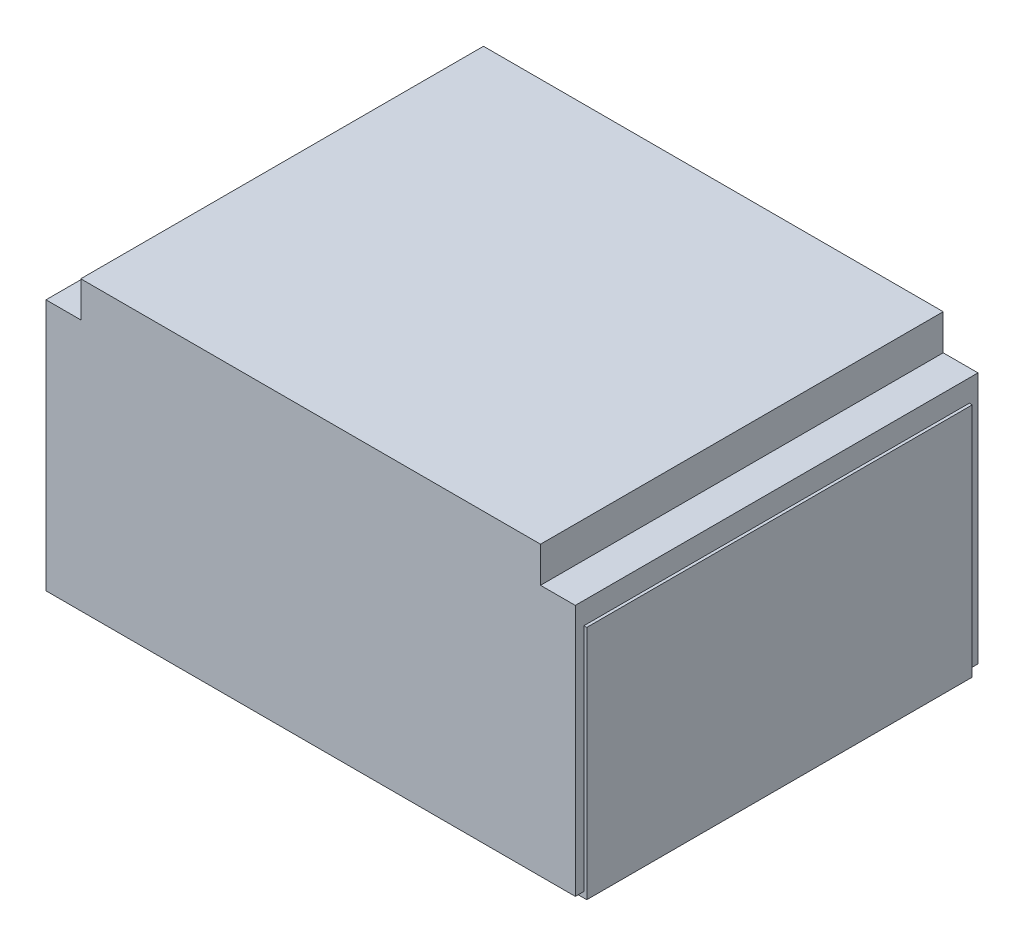
from build123d import *

# Parameters (mm, degrees)
SZKIC1_W                    = 4.6
SZKIC1_H                    = 2.5
DODANIE_WYCI_GNI_CIE1_DEPTH = 3.5
SZKIC2_W                    = 0.302200239
SZKIC2_H                    = 0.309416308
WYTNIJ_WYCI_GNI_CIE1_DEPTH  = 5.370640685
SZKIC3_W                    = 4.65
SZKIC3_H                    = 3.35
DODANIE_WYCI_GNI_CIE2_DEPTH = 0.05
SZKIC4_R                    = 0.162382369
SZKIC4_R_2                  = 1.05
WYTNIJ_WYCI_GNI_CIE2_DEPTH  = 0.05
SZKIC5_R                    = 1
DODANIE_WYCI_GNI_CIE3_DEPTH = 0.4
ZAOKR_GLENIE1_R             = 0.05
SZKIC6_W                    = 0.025
SZKIC6_H                    = 3.35
DODANIE_WYCI_GNI_CIE4_DEPTH = 2


with BuildPart() as part:
    # Szkic1 → Dodanie-wyciągnięcie1 (new body)
    with BuildSketch(Plane.XY):
        Rectangle(SZKIC1_W, SZKIC1_H)
    extrude(amount=DODANIE_WYCI_GNI_CIE1_DEPTH)

    # Szkic2 → Wytnij-wyciągnięcie1 (cut, through all)
    with BuildSketch(Plane.XY.offset(3.5)):
        with Locations((-2.148899881, 1.095291846)):
            Rectangle(SZKIC2_W, SZKIC2_H)
        with Locations((2.148899881, 1.095291846)):
            Rectangle(SZKIC2_W, SZKIC2_H)
    extrude(amount=-WYTNIJ_WYCI_GNI_CIE1_DEPTH, mode=Mode.SUBTRACT)


with BuildPart() as body_2:
    # Szkic3 → Dodanie-wyciągnięcie2 (new body)
    with BuildSketch(Plane.XZ.offset(1.25)):
        with Locations((0, 1.75)):
            Rectangle(SZKIC3_W, SZKIC3_H)
    extrude(amount=DODANIE_WYCI_GNI_CIE2_DEPTH)

    # Szkic4 → Wytnij-wyciągnięcie2 (cut)
    with BuildSketch(Plane.XZ.offset(1.3)):
        with Locations((-1.92312306, 3.089394939)):
            Circle(SZKIC4_R)
        with Locations(Location((1.92312306, 3.089394939, 0), (0, 0, 180))):
            Circle(SZKIC4_R)
        with Locations((0, 1.59590093)):
            Circle(SZKIC4_R_2)
        Polygon((-1.74824974, 0.075), (-1.74824974, 0.441313237), (-1.648322128, 0.441313237), (-1.473448808, 0.191494209), (1.473448808, 0.191494209), (1.648322128, 0.441313237), (1.74824974, 0.441313237), (1.74824974, 0.075), align=None)
    extrude(amount=-WYTNIJ_WYCI_GNI_CIE2_DEPTH, mode=Mode.SUBTRACT)

    # Szkic6 → Dodanie-wyciągnięcie4 (add)
    with BuildSketch(Plane(origin=(0, -1.25, 0), x_dir=(1, 0, 0), z_dir=(0, 1, 0))):
        with Locations((-2.3125, -1.75)):
            Rectangle(SZKIC6_W, SZKIC6_H)
        with Locations((2.3125, -1.75)):
            Rectangle(SZKIC6_W, SZKIC6_H)
    extrude(amount=DODANIE_WYCI_GNI_CIE4_DEPTH)


with BuildPart() as body_3:
    # Szkic5 → Dodanie-wyciągnięcie3 (new body)
    with BuildSketch(Plane.XZ.offset(1.25)):
        with Locations((0, 1.59590093)):
            Circle(SZKIC5_R)
    extrude(amount=DODANIE_WYCI_GNI_CIE3_DEPTH)

    # Zaokrąglenie1
    zaokr_glenie1_edges = [body_3.edges().sort_by_distance(p)[0] for p in [
        (-1, -1.65, 1.59590093),
    ]]
    fillet(zaokr_glenie1_edges, radius=ZAOKR_GLENIE1_R)


solid = Compound([part.part, body_2.part, body_3.part])
